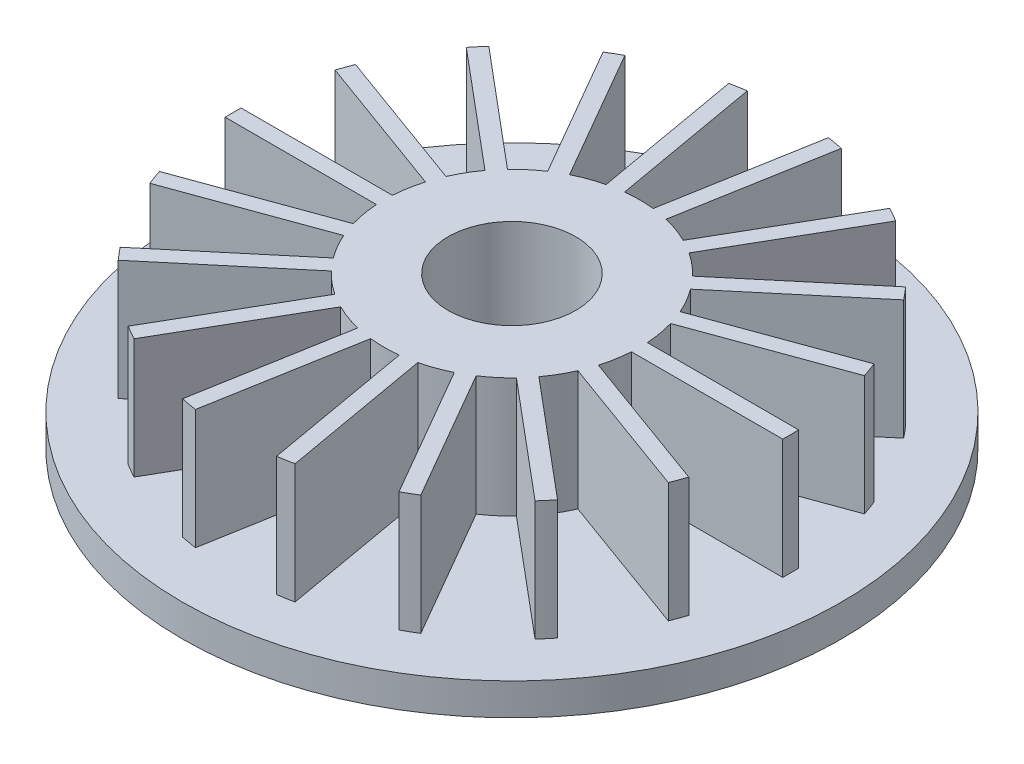
from build123d import *

# Parameters (mm, degrees)
SKETCH1_R           = 8
BOSS_EXTRUDE1_DEPTH = 7.5
SKETCH2_W           = 24
SKETCH2_H           = 1
BOSS_EXTRUDE2_DEPTH = 7.5
SKETCH5_W           = 30
SKETCH5_H           = 10
SKETCH6_R           = 20.6375
BOSS_EXTRUDE3_DEPTH = 2
SKETCH7_R           = 4
CUT_EXTRUDE2_DEPTH  = 31.69304176


with BuildPart() as part:
    # Sketch1 → Boss-Extrude1 (new body)
    with BuildSketch(Plane(origin=(0, 0, 0), x_dir=(1, 0, 0), z_dir=(0, 1, 0))):
        with Locations(Location((0, 0, 0), (0, 0, 270))):
            Circle(SKETCH1_R)
    extrude(amount=BOSS_EXTRUDE1_DEPTH)

    # Sketch2 → Boss-Extrude2 (add)
    with BuildSketch(Plane.XZ):
        with Locations((17.4625, 0)):
            Rectangle(SKETCH2_W, SKETCH2_H)
        Polygon((27.514683768, -10.546614783), (4.962060869, -2.338131343), (5.304081013, -1.398438723), (27.856703912, -9.606922162), align=None)
        Polygon((22.248190601, -19.321152172), (3.863123966, -3.894249539), (4.505911575, -3.128205096), (22.89097821, -18.555107729), align=None)
        Polygon((14.298237298, -25.765273459), (2.298237298, -4.980663768), (3.164262702, -4.480663768), (15.164262702, -25.265273459), align=None)
        Polygon((4.623705558, -29.101722512), (0.456149294, -5.46633644), (1.440957047, -5.292688262), (5.608513311, -28.928074334), align=None)
        Polygon((-5.608513311, -28.928074334), (-1.440957047, -5.292688262), (-0.456149294, -5.46633644), (-4.623705558, -29.101722512), align=None)
        Polygon((-15.164262702, -25.265273459), (-3.164262702, -4.480663768), (-2.298237298, -4.980663768), (-14.298237298, -25.765273459), align=None)
        Polygon((-22.89097821, -18.555107729), (-4.505911575, -3.128205096), (-3.863123966, -3.894249539), (-22.248190601, -19.321152172), align=None)
        Polygon((-27.856703912, -9.606922162), (-5.304081013, -1.398438723), (-4.962060869, -2.338131343), (-27.514683768, -10.546614783), align=None)
        with Locations((-17.4625, 0)):
            Rectangle(SKETCH2_W, SKETCH2_H)
        Polygon((-27.514683768, 10.546614783), (-4.962060869, 2.338131343), (-5.304081013, 1.398438723), (-27.856703912, 9.606922162), align=None)
        Polygon((-22.248190601, 19.321152172), (-3.863123966, 3.894249539), (-4.505911575, 3.128205096), (-22.89097821, 18.555107729), align=None)
        Polygon((-14.298237298, 25.765273459), (-2.298237298, 4.980663768), (-3.164262702, 4.480663768), (-15.164262702, 25.265273459), align=None)
        Polygon((-4.623705558, 29.101722512), (-0.456149294, 5.46633644), (-1.440957047, 5.292688262), (-5.608513311, 28.928074334), align=None)
        Polygon((5.608513311, 28.928074334), (1.440957047, 5.292688262), (0.456149294, 5.46633644), (4.623705558, 29.101722512), align=None)
        Polygon((15.164262702, 25.265273459), (3.164262702, 4.480663768), (2.298237298, 4.980663768), (14.298237298, 25.765273459), align=None)
        Polygon((22.89097821, 18.555107729), (4.505911575, 3.128205096), (3.863123966, 3.894249539), (22.248190601, 19.321152172), align=None)
        Polygon((27.856703912, 9.606922162), (5.304081013, 1.398438723), (4.962060869, 2.338131343), (27.514683768, 10.546614783), align=None)
    extrude(amount=-BOSS_EXTRUDE2_DEPTH)

    # Sketch5 → Cut-Revolve1 (revolve, cut)
    with BuildSketch(Plane(origin=(0, 0, 0), x_dir=(0, 0, -1), z_dir=(1, 0, 0))):
        with Locations((32.4625, 4)):
            Rectangle(SKETCH5_W, SKETCH5_H)
    revolve(axis=Axis((0, 0, 0), (0, 1, 0)), mode=Mode.SUBTRACT)

    # Sketch6 → Boss-Extrude3 (add)
    with BuildSketch(Plane(origin=(0, 0, 0), x_dir=(1, 0, 0), z_dir=(0, 1, 0))):
        with Locations(Location((0, 0, 0), (0, 0, 270))):
            Circle(SKETCH6_R)
    extrude(amount=-BOSS_EXTRUDE3_DEPTH)

    # Sketch7 → Cut-Extrude2 (cut, through all)
    with BuildSketch(Plane(origin=(0, 7.5, 0), x_dir=(1, 0, 0), z_dir=(0, 1, 0))):
        with Locations(Location((0, 0, 0), (0, 0, 270))):
            Circle(SKETCH7_R)
    extrude(amount=-CUT_EXTRUDE2_DEPTH, mode=Mode.SUBTRACT)


solid = part.part
